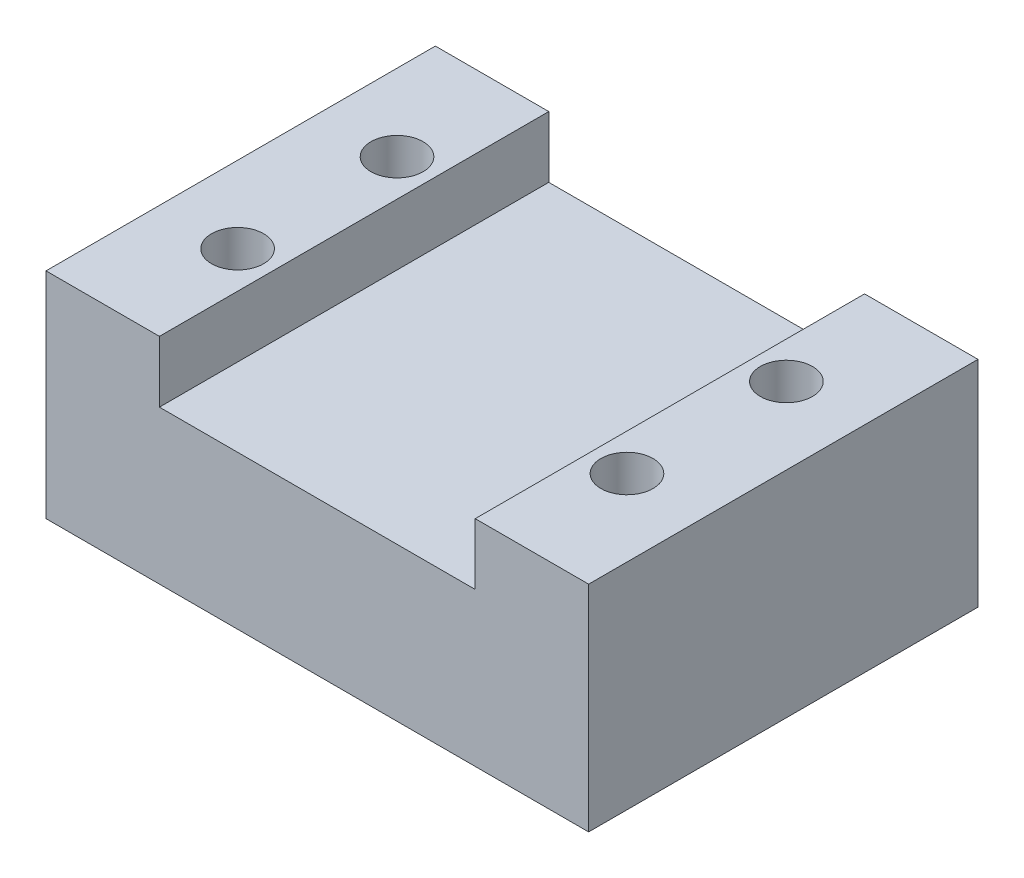
from build123d import *

# Parameters (mm, degrees)
CROQUIS1_W                   = 35.4
CROQUIS1_H                   = 25.4
SALIENTE_EXTRUIR1_DEPTH      = 10
CROQUIS2_W                   = 7.4
CROQUIS2_H                   = 25.4
SALIENTE_EXTRUIR2_DEPTH      = 4
TALADRO_DE_MARGEN_PARA_M31_D = 3.4
CORTAR_EXTRUIR1_DEPTH        = 2
MATRIZL2_COUNT               = 2
MATRIZL2_PITCH               = 25.4
MATRIZL2_COUNT_DIR2          = 2
MATRIZL2_PITCH_DIR2          = 10.4


with BuildPart() as part:
    # Croquis1 → Saliente-Extruir1 (new body)
    with BuildSketch(Plane(origin=(0, 0, 0), x_dir=(1, 0, 0), z_dir=(0, 1, 0))):
        Rectangle(CROQUIS1_W, CROQUIS1_H)
    extrude(amount=SALIENTE_EXTRUIR1_DEPTH)

    # Croquis2 → Saliente-Extruir2 (add)
    with BuildSketch(Plane(origin=(0, 10, 0), x_dir=(1, 0, 0), z_dir=(0, 1, 0))):
        with Locations((-14, 0)):
            Rectangle(CROQUIS2_W, CROQUIS2_H)
    saliente_extruir2 = extrude(amount=SALIENTE_EXTRUIR2_DEPTH)

    # Simetría1: Saliente-Extruir2 across plane
    add(saliente_extruir2.mirror(Plane(origin=(0, 0, 0), x_dir=(0, 0, 1), z_dir=(1, 0, 0))))

    # Taladro de margen para M31 (through all)
    with Locations(Plane(origin=(0, 14, 0), x_dir=(1, 0, 0), z_dir=(0, 1, 0))):
        with Locations((-12.7, 5.2), (12.7, -5.2), (12.7, 5.2), (-12.7, -5.2)):
            Hole(TALADRO_DE_MARGEN_PARA_M31_D / 2)

    # Croquis6 → Cortar-Extruir1 (cut)
    with BuildSketch(Plane.XZ):
        Polygon((-9.7, 6.932050808), (-12.7, 8.664101615), (-15.7, 6.932050808), (-15.7, 3.467949192), (-12.7, 1.735898385), (-9.7, 3.467949192), align=None)
    cortar_extruir1 = extrude(amount=-CORTAR_EXTRUIR1_DEPTH, mode=Mode.SUBTRACT)

    # MatrizL2: Cortar-Extruir1 2 × 2
    with Locations(*[(i * MATRIZL2_PITCH, 0, -j * MATRIZL2_PITCH_DIR2) for i in range(MATRIZL2_COUNT) for j in range(MATRIZL2_COUNT_DIR2) if (i, j) != (0, 0)]):
        add(cortar_extruir1, mode=Mode.SUBTRACT)


solid = part.part
